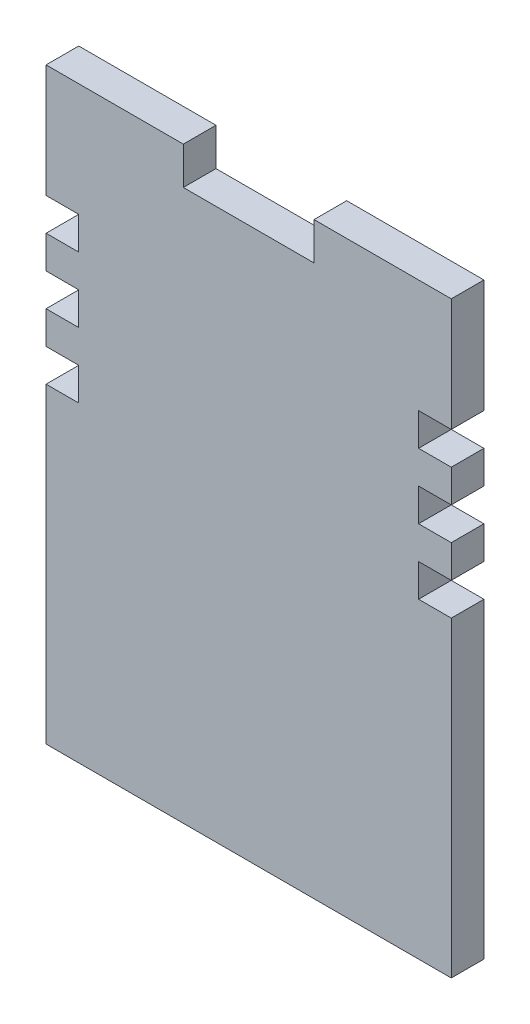
from build123d import *

# Parameters (mm, degrees)
BOSS_EXTRU_1_DEPTH = 5


with BuildPart() as part:
    # Esquisse2 → Boss.-Extru.1 (new body)
    with BuildSketch(Plane.XY):
        Polygon((71.436017117, 166.854307047), (71.436017117, 161.108741686), (51.436017117, 161.108741686), (51.436017117, 166.854307047), (30.436017117, 166.854307047), (30.436017117, 149.544307047), (35.436017117, 149.544307047), (35.436017117, 144.544307047), (30.436017117, 144.544307047), (30.436017117, 139.544307047), (35.436017117, 139.544307047), (35.436017117, 134.544307047), (30.436017117, 134.544307047), (30.436017117, 129.544307047), (35.436017117, 129.544307047), (35.436017117, 124.544307047), (30.436017117, 124.544307047), (30.436017117, 76.854307047), (61.436017117, 76.854307047), (92.436017117, 76.854307047), (92.436017117, 124.544307047), (87.436017117, 124.544307047), (87.436017117, 129.544307047), (92.436017117, 129.544307047), (92.436017117, 134.544307047), (87.436017117, 134.544307047), (87.436017117, 139.544307047), (92.436017117, 139.544307047), (92.436017117, 144.544307047), (87.436017117, 144.544307047), (87.436017117, 149.544307047), (92.436017117, 149.544307047), (92.436017117, 166.854307047), align=None)
    extrude(amount=BOSS_EXTRU_1_DEPTH)


solid = part.part
